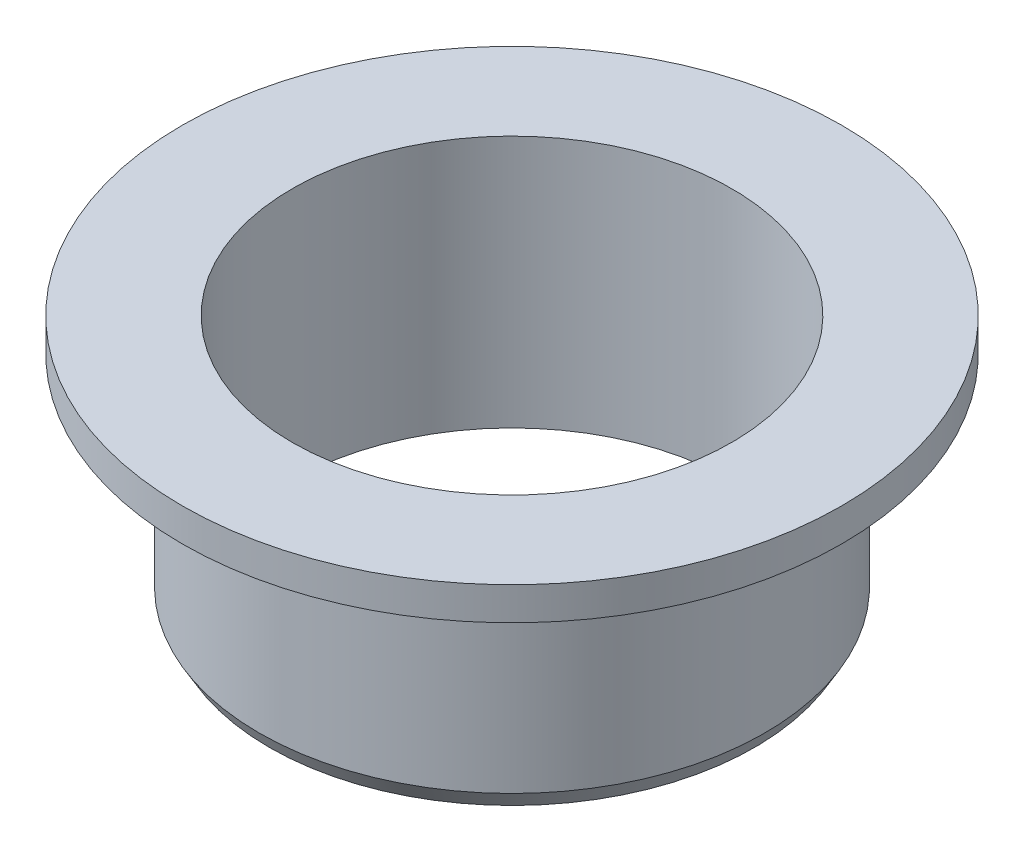
from build123d import *


with BuildPart() as part:
    # Sketch1 → Revolve1 (revolve)
    with BuildSketch(Plane.XY, mode=Mode.PRIVATE) as revolve1_sk:
        with BuildLine():
            Line((-15, 0), (-15, -1.5))
            Line((-15, -1.5), (-12, -1.5))
            ThreePointArc((-12, -1.5), (-11.646446609, -1.646446609), (-11.5, -2))
            Line((-11.5, -2), (-11.5, -10.7))
            Line((-11.5, -10.7), (-11.038119785, -11.5))
            Line((-11.038119785, -11.5), (-10, -11.5))
            Line((-10, -11.5), (-10, 0))
            Line((-10, 0), (-15, 0))
        make_face()
    revolve(revolve1_sk.sketch.rotate(Axis((0, 0, 0), (0, -1, 0)), 270), axis=Axis((0, 0, 0), (0, -1, 0)))


solid = part.part
